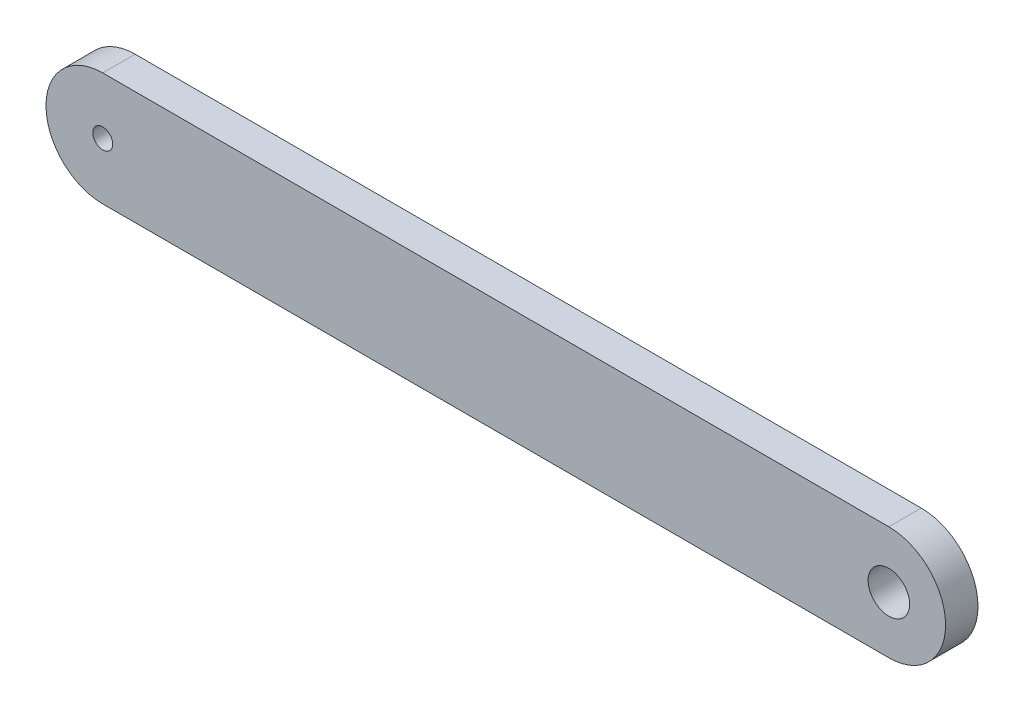
from build123d import *

# Parameters (mm, degrees)
BOSS_EXTRUDE1_DEPTH = 5.08
CUT_EXTRUDE1_DEPTH  = 2.54
SKETCH5_R           = 1.5621
CUT_EXTRUDE2_DEPTH  = 133.476280518
SKETCH2_R           = 3.2512
CUT_EXTRUDE3_DEPTH  = 133.476280518


with BuildPart() as part:
    # Sketch1 → Boss-Extrude1 (new body)
    with BuildSketch(Plane.XY):
        with BuildLine():
            Line((0, 8.89), (123.19, 8.89))
            ThreePointArc((123.19, 8.89), (132.08, 0), (123.19, -8.89))
            Line((123.19, -8.89), (0, -8.89))
            ThreePointArc((0, -8.89), (-8.89, 0), (0, 8.89))
        make_face()
    extrude(amount=BOSS_EXTRUDE1_DEPTH)

    # Sketch4 → Cut-Extrude1 (cut)
    with BuildSketch(Plane(origin=(0, 0, 0), x_dir=(-1, 0, 0), z_dir=(0, 0, -1))):
        with BuildLine():
            Line((-5.600440074, 4.064037393), (-16.637267213, 2.893836949))
            ThreePointArc((-16.637267213, 2.893836949), (-19.240499434, -0.001815049), (-16.63365711, -2.89421744))
            Line((-16.63365711, -2.89421744), (-5.349174405, -4.076443038))
            ThreePointArc((-5.349174405, -4.076443038), (-4.669876023, -4.256197229), (-4.077266325, -4.633783784))
            ThreePointArc((-4.077266325, -4.633783784), (0, -6.1722), (4.077266325, -4.633783784))
            ThreePointArc((4.077266325, -4.633783784), (4.669876023, -4.256197229), (5.349174405, -4.076443038))
            Line((5.349174405, -4.076443038), (16.63365711, -2.89421744))
            ThreePointArc((16.63365711, -2.89421744), (19.2405, 0), (16.63365711, 2.89421744))
            Line((16.63365711, 2.89421744), (5.349174405, 4.076443038))
            ThreePointArc((5.349174405, 4.076443038), (4.669876023, 4.256197229), (4.077266325, 4.633783784))
            ThreePointArc((4.077266325, 4.633783784), (0, 6.1722), (-4.077266325, 4.633783784))
            ThreePointArc((-4.077266325, 4.633783784), (-4.786476333, 4.20888501), (-5.600440074, 4.064037393))
        make_face()
    extrude(amount=-CUT_EXTRUDE1_DEPTH, mode=Mode.SUBTRACT)

    # Sketch5 → Cut-Extrude2 (cut, through all)
    with BuildSketch(Plane.XY.offset(5.08)):
        Circle(SKETCH5_R)
    extrude(amount=-CUT_EXTRUDE2_DEPTH, mode=Mode.SUBTRACT)

    # Sketch2 → Cut-Extrude3 (cut, through all)
    with BuildSketch(Plane(origin=(0, 0, 0), x_dir=(-1, 0, 0), z_dir=(0, 0, -1))):
        with Locations((-123.19, 0)):
            Circle(SKETCH2_R)
    extrude(amount=-CUT_EXTRUDE3_DEPTH, mode=Mode.SUBTRACT)


solid = part.part
